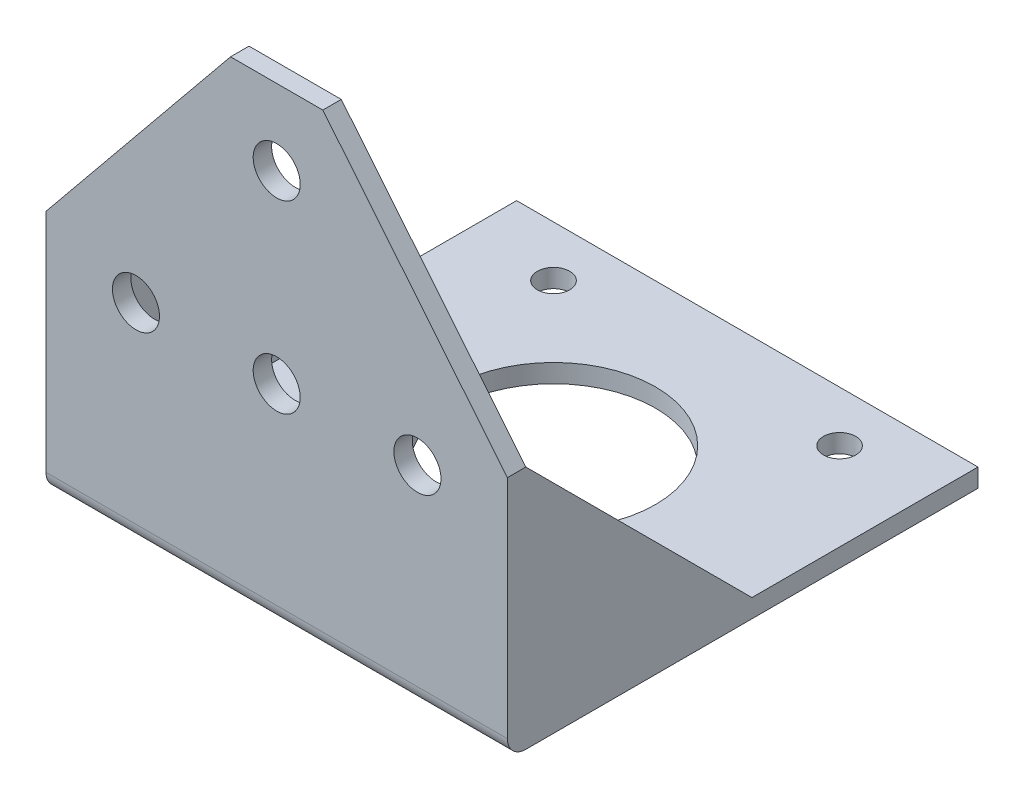
from build123d import *

# Parameters (mm, degrees)
SKETCH1_W           = 50
SKETCH1_H           = 51
BOSS_EXTRUDE1_DEPTH = 2
SKETCH2_R           = 11.05
SKETCH2_R_2         = 1.75
CUT_EXTRUDE1_DEPTH  = 3
SKETCH4_W           = 50
SKETCH4_H           = 2
BOSS_EXTRUDE2_DEPTH = 49
BOSS_EXTRUDE3_DEPTH = 2
BOSS_EXTRUDE4_DEPTH = 2
SKETCH7_R           = 2.55
CUT_EXTRUDE2_DEPTH  = 2
FILLET1_R           = 2
SKETCH8_R           = 2.55
CUT_EXTRUDE4_DEPTH  = 2


with BuildPart() as part:
    # Sketch1 → Boss-Extrude1 (new body)
    with BuildSketch(Plane(origin=(0, 0, 0), x_dir=(1, 0, 0), z_dir=(0, 1, 0))):
        with Locations((0, -4.5)):
            Rectangle(SKETCH1_W, SKETCH1_H)
    extrude(amount=BOSS_EXTRUDE1_DEPTH)

    # Sketch2 → Cut-Extrude1 (cut)
    with BuildSketch(Plane(origin=(0, 2, 0), x_dir=(1, 0, 0), z_dir=(0, 1, 0))):
        with Locations(Location((0, 0, 0), (0, 0, 270))):
            Circle(SKETCH2_R)
        with Locations(Location((-15.5, 15.5, 0), (0, 0, 270))):
            Circle(SKETCH2_R_2)
        with Locations(Location((-15.5, -15.5, 0), (0, 0, 270))):
            Circle(SKETCH2_R_2)
        with Locations(Location((15.5, -15.5, 0), (0, 0, 270))):
            Circle(SKETCH2_R_2)
        with Locations(Location((15.5, 15.5, 0), (0, 0, 270))):
            Circle(SKETCH2_R_2)
    extrude(amount=-CUT_EXTRUDE1_DEPTH, mode=Mode.SUBTRACT)

    # Sketch4 → Boss-Extrude2 (add)
    with BuildSketch(Plane(origin=(0, 2, 0), x_dir=(1, 0, 0), z_dir=(0, 1, 0))):
        with Locations((0, -29)):
            Rectangle(SKETCH4_W, SKETCH4_H)
    extrude(amount=BOSS_EXTRUDE2_DEPTH)

    # Sketch5 → Boss-Extrude3 (add)
    with BuildSketch(Plane(origin=(25, 0, 0), x_dir=(0, 0, -1), z_dir=(1, 0, 0))):
        Polygon((-28, 26.5), (-3.5, 2), (-28, 2), align=None)
    extrude(amount=-BOSS_EXTRUDE3_DEPTH)

    # Sketch6 → Boss-Extrude4 (add)
    with BuildSketch(Plane.ZY.offset(25)):
        Polygon((28, 26.5), (3.5, 2), (28, 2), align=None)
    extrude(amount=-BOSS_EXTRUDE4_DEPTH)

    # Sketch7 → Cut-Extrude2 (cut)
    with BuildSketch(Plane(origin=(0, 0, 28), x_dir=(-1, 0, 0), z_dir=(0, 0, -1))):
        with Locations((0, 22.8)):
            Circle(SKETCH7_R)
        with Locations((0, 42.8)):
            Circle(SKETCH7_R)
        with Locations((15.25, 22.8)):
            Circle(SKETCH7_R)
        with Locations((15.25, 42.8)):
            Circle(SKETCH7_R)
        with Locations(Location((-15.25, 42.8, 0), (0, 0, 180))):
            Circle(SKETCH7_R)
        with Locations(Location((-15.25, 22.8, 0), (0, 0, 180))):
            Circle(SKETCH7_R)
    extrude(amount=-CUT_EXTRUDE2_DEPTH, mode=Mode.SUBTRACT)

    # Fillet1
    fillet1_edges = [part.edges().sort_by_distance(p)[0] for p in [
        (0, 0, 30),
        (0, 2, 28),
    ]]
    fillet(fillet1_edges, radius=FILLET1_R)

    # Sketch8 → Cut-Extrude4 (cut)
    # profile 1 of 2: a face of its own
    with BuildSketch(Plane(origin=(0, 0, 28), x_dir=(-1, 0, 0), z_dir=(0, 0, -1))):
        Polygon((25, 51), (5, 51), (25, 26.5), align=None)
        with Locations((15.25, 42.8)):
            Circle(SKETCH8_R, mode=Mode.SUBTRACT)
    # profile 2 of 2: a face of its own
    with BuildSketch(Plane(origin=(0, 0, 28), x_dir=(-1, 0, 0), z_dir=(0, 0, -1))):
        Polygon((-25, 26.5), (-5, 51), (-25, 51), align=None)
        with Locations((-15.25, 42.8)):
            Circle(SKETCH8_R, mode=Mode.SUBTRACT)
    extrude(amount=-CUT_EXTRUDE4_DEPTH, mode=Mode.SUBTRACT)


solid = part.part
